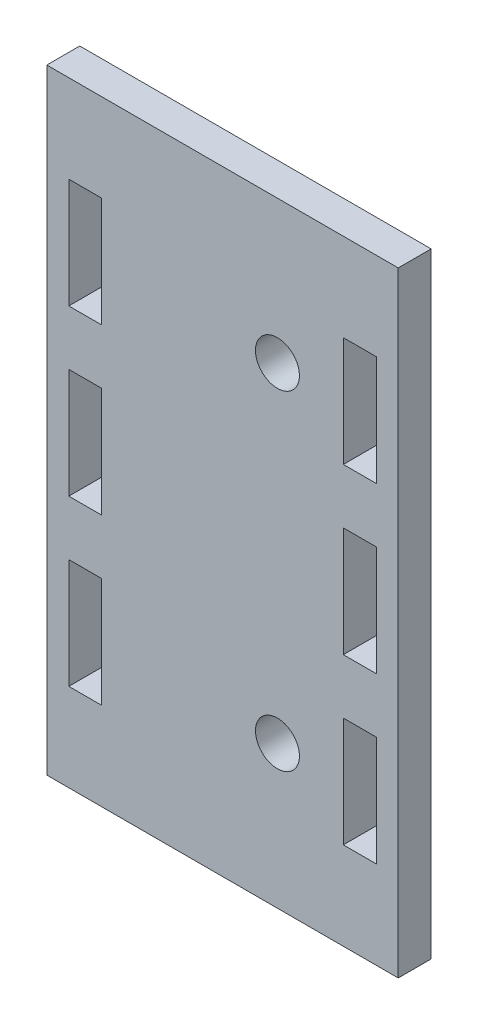
from build123d import *

# Parameters (mm, degrees)
SKETCH_1_W      = 3
SKETCH_1_H      = 10
SKETCH_1_R      = 2
EXTRUDE_1_DEPTH = 3


with BuildPart() as part:
    # 草图1 → 凸台-拉伸1 (new body)
    with BuildSketch(Plane.XY):
        Polygon((25, -25), (25, 25), (25, 28), (-7, 28), (-7, 25), (-7, -25), (-7, -28), (25, -28), align=None)
        with Locations((-3.5, -15)):
            Rectangle(SKETCH_1_W, SKETCH_1_H, mode=Mode.SUBTRACT)
        with Locations((14, -15)):
            Circle(SKETCH_1_R, mode=Mode.SUBTRACT)
        with Locations((21.5, -15)):
            Rectangle(SKETCH_1_W, SKETCH_1_H, mode=Mode.SUBTRACT)
        with Locations((-3.5, 0)):
            Rectangle(SKETCH_1_W, SKETCH_1_H, mode=Mode.SUBTRACT)
        with Locations((-3.5, 15)):
            Rectangle(SKETCH_1_W, SKETCH_1_H, mode=Mode.SUBTRACT)
        with Locations((21.5, 0)):
            Rectangle(SKETCH_1_W, SKETCH_1_H, mode=Mode.SUBTRACT)
        with Locations((14, 15)):
            Circle(SKETCH_1_R, mode=Mode.SUBTRACT)
        with Locations((21.5, 15)):
            Rectangle(SKETCH_1_W, SKETCH_1_H, mode=Mode.SUBTRACT)
    extrude(amount=EXTRUDE_1_DEPTH)


solid = part.part
